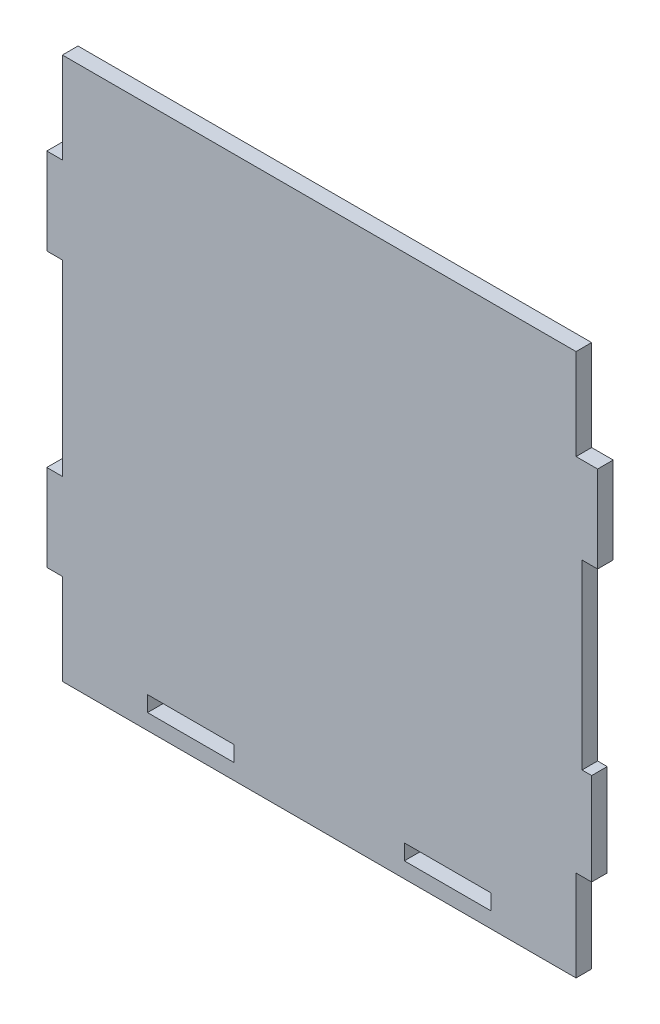
from build123d import *

# Parameters (mm, degrees)
SKETCH1_W           = 100
SKETCH1_H           = 18
BOSS_EXTRUDE1_DEPTH = 18


with BuildPart() as part:
    # Sketch1 → Boss-Extrude1 (new body)
    with BuildSketch(Plane.XY):
        Polygon((-204.09418278, -205), (-204.09418278, -415), (-192.971781752, -415), (-192.971781752, -521.450726938), (-210.971781752, -521.450726938), (-210.971781752, -626.450726938), (-804.09418278, -626.450726938), (-804.09418278, -521.450726938), (-822.09418278, -521.450726938), (-822.09418278, -421.450726938), (-804.09418278, -421.450726938), (-804.09418278, -205), (-822.09418278, -205), (-822.09418278, -105), (-804.09418278, -105), (-804.09418278, 0), (-210.971781752, 0), (-210.971781752, -105), (-186.09418278, -105), (-186.09418278, -205), align=None)
        with Locations((-359.252382009, -599.450726938)):
            Rectangle(SKETCH1_W, SKETCH1_H, mode=Mode.SUBTRACT)
        with Locations((-655.813582523, -599.450726938)):
            Rectangle(SKETCH1_W, SKETCH1_H, mode=Mode.SUBTRACT)
    extrude(amount=BOSS_EXTRUDE1_DEPTH)


solid = part.part
